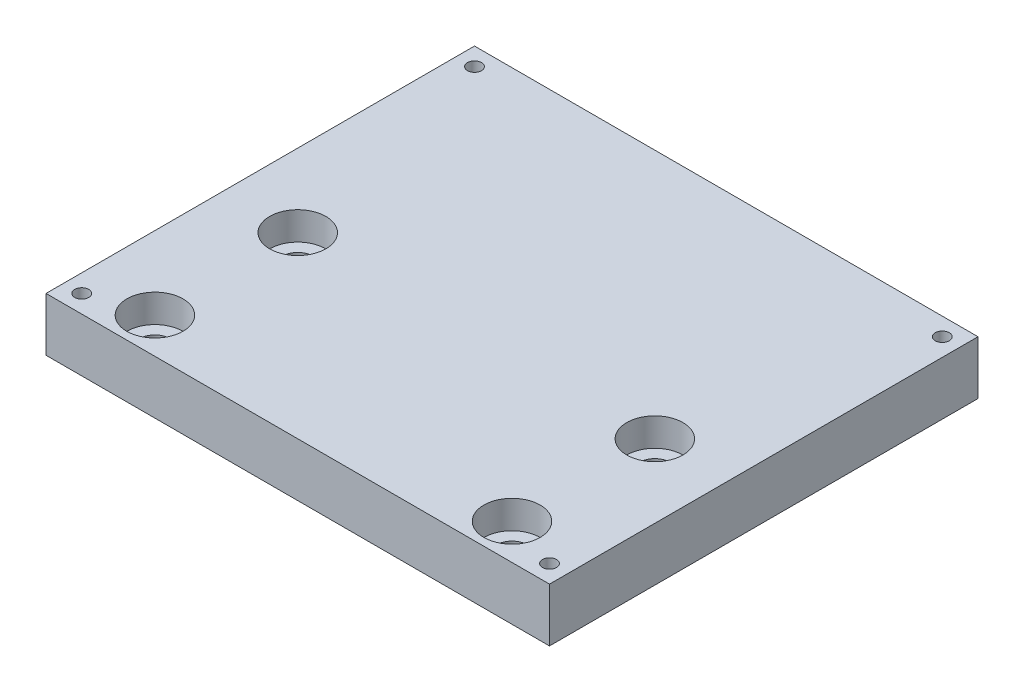
from build123d import *

# Parameters (mm, degrees)
SKETCH1_W                      = 89.535
SKETCH1_H                      = 76.2
EXTRUDE1_DEPTH                 = 9.525
CBORE_FOR_M5_SHCS3_D           = 5.5
CBORE_FOR_M5_SHCS3_CBORE_D     = 10
CBORE_FOR_M5_SHCS3_CBORE_DEPTH = 5
LPATTERN4_COUNT                = 2
LPATTERN4_PITCH                = 63.5
LPATTERN4_COUNT_DIR2           = 2
LPATTERN4_PITCH_DIR2           = 25.4
M3X0_5_TAPPED_HOLE2_D          = 2.5
LPATTERN5_COUNT                = 2
LPATTERN5_PITCH                = 83.185
LPATTERN5_COUNT_DIR2           = 2
LPATTERN5_PITCH_DIR2           = 69.85


with BuildPart() as part:
    # Sketch1 → Extrude1 (new body)
    with BuildSketch(Plane(origin=(0, 0, 0), x_dir=(1, 0, 0), z_dir=(0, 1, 0))):
        Rectangle(SKETCH1_W, SKETCH1_H)
    extrude(amount=EXTRUDE1_DEPTH)

    # CBORE for M5 SHCS3 (through all)
    with Locations(Plane(origin=(-31.75, 9.525, 31.75), x_dir=(0, 0, 1), z_dir=(0, 1, 0))):
        with Locations((0, 0)):
            cbore_for_m5_shcs3 = CounterBoreHole(CBORE_FOR_M5_SHCS3_D / 2, CBORE_FOR_M5_SHCS3_CBORE_D / 2, CBORE_FOR_M5_SHCS3_CBORE_DEPTH)

    # LPattern4: CBORE for M5 SHCS3 2 × 2
    with Locations(*[(i * LPATTERN4_PITCH, 0, -j * LPATTERN4_PITCH_DIR2) for i in range(LPATTERN4_COUNT) for j in range(LPATTERN4_COUNT_DIR2) if (i, j) != (0, 0)]):
        add(cbore_for_m5_shcs3, mode=Mode.SUBTRACT)

    # M3x0.5 Tapped Hole2 (through all)
    with Locations(Plane(origin=(-41.5925, 9.525, 34.925), x_dir=(0, 0, 1), z_dir=(0, 1, 0))):
        with Locations((0, 0)):
            m3x0_5_tapped_hole2 = Hole(M3X0_5_TAPPED_HOLE2_D / 2)

    # LPattern5: M3x0.5 Tapped Hole2 2 × 2
    with Locations(*[(i * LPATTERN5_PITCH, 0, -j * LPATTERN5_PITCH_DIR2) for i in range(LPATTERN5_COUNT) for j in range(LPATTERN5_COUNT_DIR2) if (i, j) != (0, 0)]):
        add(m3x0_5_tapped_hole2, mode=Mode.SUBTRACT)


solid = part.part
